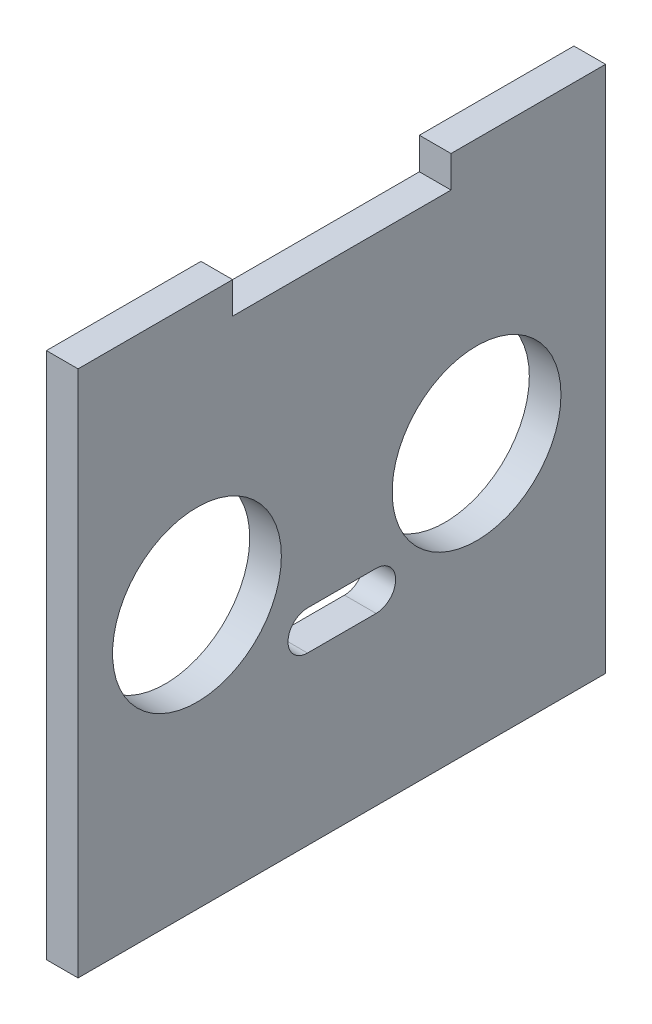
from build123d import *

# Parameters (mm, degrees)
BOSS_EXTRUDE1_DEPTH = 3
SKETCH2_R           = 8
CUT_EXTRUDE1_DEPTH  = 36.482389998


with BuildPart() as part:
    # Sketch1 → Boss-Extrude1 (new body)
    with BuildSketch(Plane(origin=(0, 0, 0), x_dir=(0, 0, -1), z_dir=(1, 0, 0))):
        Polygon((-25, 25), (-10.35, 25), (-10.35, 22), (10.35, 22), (10.35, 25), (25, 25), (25, -25), (-25, -25), align=None)
    extrude(amount=BOSS_EXTRUDE1_DEPTH)

    # Sketch2 → Cut-Extrude1 (cut, through all)
    with BuildSketch(Plane(origin=(3, 0, 0), x_dir=(0, 0, -1), z_dir=(1, 0, 0))):
        with Locations((-13.73, 0)):
            Circle(SKETCH2_R)
        with Locations((12.77, 0)):
            Circle(SKETCH2_R)
        with BuildLine():
            Line((-3.25, -5.5), (3.25, -5.5))
            ThreePointArc((3.25, -5.5), (5.1, -7.35), (3.25, -9.2))
            Line((3.25, -9.2), (-3.25, -9.2))
            ThreePointArc((-3.25, -9.2), (-5.1, -7.35), (-3.25, -5.5))
        make_face()
    extrude(amount=-CUT_EXTRUDE1_DEPTH, mode=Mode.SUBTRACT)


solid = part.part
